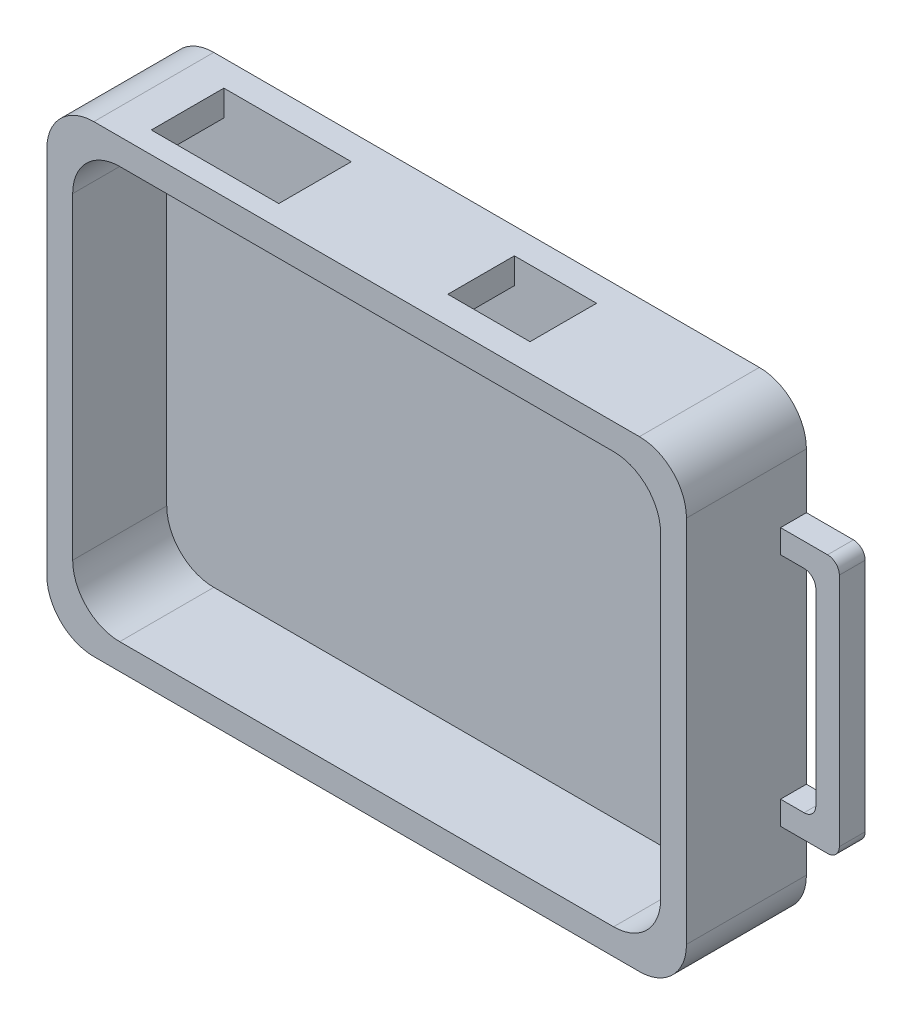
from build123d import *

# Parameters (mm, degrees)
BOSS_EXTRUDE1_DEPTH = 10.2
CUT_EXTRUDE1_DEPTH  = 8
BOSS_EXTRUDE2_DEPTH = 2.2
CUT_EXTRUDE2_DEPTH  = 2.2
SKETCH6_W           = 10.84
SKETCH6_H           = 6.17
CUT_EXTRUDE3_DEPTH  = 46
SKETCH8_W           = 6.99
SKETCH8_H           = 5.66
CUT_EXTRUDE4_DEPTH  = 29


with BuildPart() as part:
    # Sketch1 → Boss-Extrude1 (new body)
    with BuildSketch(Plane.XY):
        with BuildLine():
            Line((23.2, -19.7), (-23.2, -19.7))
            ThreePointArc((-23.2, -19.7), (-26.028427125, -18.528427125), (-27.2, -15.7))
            Line((-27.2, -15.7), (-27.2, 15.7))
            ThreePointArc((-27.2, 15.7), (-26.028427125, 18.528427125), (-23.2, 19.7))
            Line((-23.2, 19.7), (23.2, 19.7))
            ThreePointArc((23.2, 19.7), (26.028427125, 18.528427125), (27.2, 15.7))
            Line((27.2, 15.7), (27.2, -15.7))
            ThreePointArc((27.2, -15.7), (26.028427125, -18.528427125), (23.2, -19.7))
        make_face()
    extrude(amount=BOSS_EXTRUDE1_DEPTH)

    # Sketch2 → Cut-Extrude1 (cut)
    with BuildSketch(Plane.XY.offset(10.2)):
        with BuildLine():
            Line((21, -17.5), (-21, -17.5))
            ThreePointArc((-21, -17.5), (-23.828427125, -16.328427125), (-25, -13.5))
            Line((-25, -13.5), (-25, 13.5))
            ThreePointArc((-25, 13.5), (-23.828427125, 16.328427125), (-21, 17.5))
            Line((-21, 17.5), (21, 17.5))
            ThreePointArc((21, 17.5), (23.828427125, 16.328427125), (25, 13.5))
            Line((25, 13.5), (25, -13.5))
            ThreePointArc((25, -13.5), (23.828427125, -16.328427125), (21, -17.5))
        make_face()
    extrude(amount=-CUT_EXTRUDE1_DEPTH, mode=Mode.SUBTRACT)

    # Sketch4 → Boss-Extrude2 (add)
    with BuildSketch(Plane.XY.offset(2.2)):
        with BuildLine():
            Line((27.2, -11), (31.2, -11))
            ThreePointArc((31.2, -11), (31.907106781, -10.707106781), (32.2, -10))
            Line((32.2, -10), (32.2, 10))
            ThreePointArc((32.2, 10), (31.907106781, 10.707106781), (31.2, 11))
            Line((31.2, 11), (27.2, 11))
            Line((27.2, 11), (27.2, -11))
        make_face()
        with BuildLine():
            Line((-27.2, 11), (-27.2, -11))
            Line((-27.2, -11), (-31.2, -11))
            ThreePointArc((-31.2, -11), (-31.907106781, -10.707106781), (-32.2, -10))
            Line((-32.2, -10), (-32.2, 10))
            ThreePointArc((-32.2, 10), (-31.907106781, 10.707106781), (-31.2, 11))
            Line((-31.2, 11), (-27.2, 11))
        make_face()
    extrude(amount=-BOSS_EXTRUDE2_DEPTH)

    # Sketch5 → Cut-Extrude2 (cut)
    with BuildSketch(Plane.XY.offset(2.2)):
        with BuildLine():
            Line((27.2, -9), (29.2, -9))
            ThreePointArc((29.2, -9), (29.907106781, -8.707106781), (30.2, -8))
            Line((30.2, -8), (30.2, 8))
            ThreePointArc((30.2, 8), (29.907106781, 8.707106781), (29.2, 9))
            Line((29.2, 9), (27.2, 9))
            Line((27.2, 9), (27.2, -9))
        make_face()
        with BuildLine():
            Line((-27.2, -9), (-27.2, 9))
            Line((-27.2, 9), (-29.2, 9))
            ThreePointArc((-29.2, 9), (-29.907106781, 8.707106781), (-30.2, 8))
            Line((-30.2, 8), (-30.2, -8))
            ThreePointArc((-30.2, -8), (-29.907106781, -8.707106781), (-29.2, -9))
            Line((-29.2, -9), (-27.2, -9))
        make_face()
    extrude(amount=-CUT_EXTRUDE2_DEPTH, mode=Mode.SUBTRACT)

    # Sketch6 → Cut-Extrude3 (cut)
    with BuildSketch(Plane(origin=(0, 0, 0), x_dir=(1, 0, 0), z_dir=(0, 1, 0))):
        with Locations((-14.720967814, -5.285)):
            Rectangle(SKETCH6_W, SKETCH6_H)
    extrude(amount=CUT_EXTRUDE3_DEPTH, mode=Mode.SUBTRACT)

    # Sketch8 → Cut-Extrude4 (cut)
    with BuildSketch(Plane(origin=(0, 0, 0), x_dir=(1, 0, 0), z_dir=(0, 1, 0))):
        with Locations((8.059896405, -5.03)):
            Rectangle(SKETCH8_W, SKETCH8_H)
    extrude(amount=CUT_EXTRUDE4_DEPTH, mode=Mode.SUBTRACT)


solid = part.part
